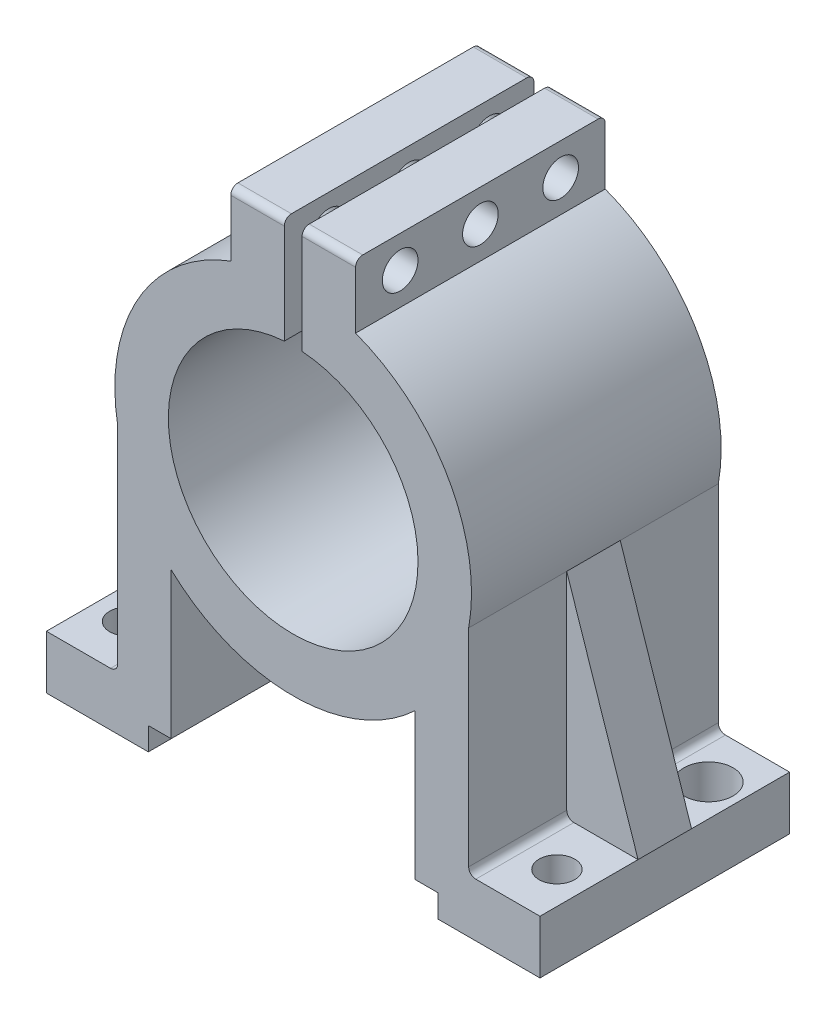
from build123d import *
from build123d.topology import SkipClean

# Parameters (mm, degrees)
BOSS_EXTRUDE1_DEPTH  = 28
BOSS_EXTRUDE2_START  = 11
BOSS_EXTRUDE2_DEPTH  = 6
CUT_EXTRUDE1_REACH   = 50.35
SKETCH3_R            = 2
FILLET1_R            = 0.8
SKETCH4_R            = 2
SKETCH4_R_2          = 2.75
CUT_EXTRUDE2_DEPTH   = 67.419950062
FILLET1_OF_MIRROR1_R = 0.8
CUT_EXTRUDE3_DEPTH   = 52.732976543


with BuildPart() as part:
    # Sketch1 → Boss-Extrude1 (new body)
    with BuildSketch(Plane.XY):
        with BuildLine():
            Line((0, 20), (0, 14))
            ThreePointArc((0, 14), (14, 0), (0, -14))
            Line((0, -14), (0, -20))
            ThreePointArc((0, -20), (7.356284672, -18.5979858), (13.681207787, -14.588507583))
            Line((13.681207787, -14.588507583), (13.681207787, -30.99669229))
            Line((13.681207787, -30.99669229), (16.241207787, -30.99669229))
            Line((16.241207787, -30.99669229), (16.241207787, -33.55669229))
            Line((16.241207787, -33.55669229), (27.681207787, -33.55669229))
            Line((27.681207787, -33.55669229), (27.681207787, -27.55669229))
            Line((27.681207787, -27.55669229), (20.481207787, -27.55669229))
            ThreePointArc((20.481207787, -27.55669229), (19.915522362, -27.322377715), (19.681207787, -26.75669229))
            Line((19.681207787, -26.75669229), (19.681207787, -3.55669229))
            ThreePointArc((19.681207787, -3.55669229), (17.38394465, 9.889310815), (7, 18.734993995))
            Line((7, 18.734993995), (7, 25.934993995))
            Line((7, 25.934993995), (0, 25.934993995))
            Line((0, 25.934993995), (0, 20))
        make_face()
    boss_extrude1 = extrude(amount=BOSS_EXTRUDE1_DEPTH)

    # Sketch2 → Boss-Extrude2 (add)
    with BuildSketch(Plane.XY.offset(BOSS_EXTRUDE2_START)):
        Polygon((19.681207787, -26.75669229), (19.681207787, -3.55669229), (27.681207787, -27.55669229), (20.481207787, -27.55669229), (19.681207787, -27.55669229), align=None)
    boss_extrude2 = extrude(amount=BOSS_EXTRUDE2_DEPTH)

    # Sketch3 → Cut-Extrude1 (cut, up to next)
    with BuildSketch(Plane(origin=(7, 0, 0), x_dir=(0, 0, -1), z_dir=(1, 0, 0)), mode=Mode.PRIVATE) as cut_extrude1_sk1:
        with Locations(Location((-23, 22.334993995, 0), (0, 0, 90))):
            Circle(SKETCH3_R)
    cut_extrude1_tool1 = extrude(cut_extrude1_sk1.sketch, amount=-CUT_EXTRUDE1_REACH, mode=Mode.PRIVATE) & part.part
    # Sketch3 → Cut-Extrude1 (cut, up to next)
    with BuildSketch(Plane(origin=(7, 0, 0), x_dir=(0, 0, -1), z_dir=(1, 0, 0)), mode=Mode.PRIVATE) as cut_extrude1_sk2:
        with Locations(Location((-14, 22.334993995, 0), (0, 0, 90))):
            Circle(SKETCH3_R)
    cut_extrude1_tool2 = extrude(cut_extrude1_sk2.sketch, amount=-CUT_EXTRUDE1_REACH, mode=Mode.PRIVATE) & part.part
    # Sketch3 → Cut-Extrude1 (cut, up to next)
    with BuildSketch(Plane(origin=(7, 0, 0), x_dir=(0, 0, -1), z_dir=(1, 0, 0)), mode=Mode.PRIVATE) as cut_extrude1_sk3:
        with Locations(Location((-5, 22.334993995, 0), (0, 0, 90))):
            Circle(SKETCH3_R)
    cut_extrude1_tool3 = extrude(cut_extrude1_sk3.sketch, amount=-CUT_EXTRUDE1_REACH, mode=Mode.PRIVATE) & part.part
    cut_extrude1_1 = cut_extrude1_tool1.solids().sort_by_distance((7, 22.334994, 23))[0]
    add(cut_extrude1_1, mode=Mode.SUBTRACT)
    cut_extrude1_2 = cut_extrude1_tool2.solids().sort_by_distance((7, 22.334994, 14))[0]
    add(cut_extrude1_2, mode=Mode.SUBTRACT)
    cut_extrude1_3 = cut_extrude1_tool3.solids().sort_by_distance((7, 22.334994, 5))[0]
    add(cut_extrude1_3, mode=Mode.SUBTRACT)
    cut_extrude1 = cut_extrude1_1 + cut_extrude1_2 + cut_extrude1_3  # Cut-Extrude1 as one shape, for the pattern or mirror that repeats it

    # Fillet1
    fillet1_edges = [part.edges().sort_by_distance(p)[0] for p in [
        (3.5, 25.934993995, 0),
        (3.5, 25.934993995, 28),
    ]]
    fillet(fillet1_edges, radius=FILLET1_R)

    # Sketch4 → Cut-Extrude2 (cut, through all)
    with BuildSketch(Plane(origin=(0, -27.55669229, 0), x_dir=(1, 0, 0), z_dir=(0, 1, 0))):
        with Locations(Location((24.081207787, -22.5, 0), (0, 0, 270))):
            Circle(SKETCH4_R)
        with Locations(Location((24.081207787, -5.5, 0), (0, 0, 270))):
            Circle(SKETCH4_R_2)
    cut_extrude2 = extrude(amount=-CUT_EXTRUDE2_DEPTH, mode=Mode.SUBTRACT)

    # Mirror1: Boss-Extrude1, Boss-Extrude2, Cut-Extrude1, Cut-Extrude2 across plane
    with SkipClean():  # the faces are left unmerged after this step: merging them gives an invalid solid
        add(boss_extrude1.mirror(Plane(origin=(0, 0, 0), x_dir=(0, 0, 1), z_dir=(1, 0, 0))))
        add(boss_extrude2.mirror(Plane(origin=(0, 0, 0), x_dir=(0, 0, 1), z_dir=(1, 0, 0))))
        add(cut_extrude1.mirror(Plane(origin=(0, 0, 0), x_dir=(0, 0, 1), z_dir=(1, 0, 0))), mode=Mode.SUBTRACT)
        add(cut_extrude2.mirror(Plane(origin=(0, 0, 0), x_dir=(0, 0, 1), z_dir=(1, 0, 0))), mode=Mode.SUBTRACT)

    # Fillet1 of Mirror1
    fillet1_of_mirror1_edges = [part.edges().sort_by_distance(p)[0] for p in [
        (-3.5, 25.934993995, 0),
        (-3.5, 25.934993995, 28),
    ]]
    fillet(fillet1_of_mirror1_edges, radius=FILLET1_OF_MIRROR1_R)

    # Sketch6 → Cut-Extrude3 (cut, through all)
    with BuildSketch(Plane.XY.offset(28)):
        with BuildLine():
            ThreePointArc((1, 13.964240044), (0, 14), (-1, 13.964240044))
            Line((-1, 13.964240044), (-1, 8.456424639))
            Line((-1, 8.456424639), (1, 8.456424639))
            Line((1, 8.456424639), (1, 13.964240044))
        make_face()
        with BuildLine():
            Line((-1, 8.456424639), (-1, 13.964240044))
            ThreePointArc((-1, 13.964240044), (-9.539392014, -10.246950766), (14, 0))
            ThreePointArc((14, 0), (10.246950766, 9.539392014), (1, 13.964240044))
            Line((1, 13.964240044), (1, 8.456424639))
            Line((1, 8.456424639), (-1, 8.456424639))
        make_face()
        with BuildLine():
            Line((0, 25.134993995), (-1, 25.134993995))
            Line((-1, 25.134993995), (-1, 13.964240044))
            ThreePointArc((-1, 13.964240044), (0, 14), (1, 13.964240044))
            Line((1, 13.964240044), (1, 25.134993995))
            Line((1, 25.134993995), (0, 25.134993995))
        make_face()
        Polygon((1, 41.813563352), (-1, 41.813563352), (-1, 25.134993995), (0, 25.134993995), (1, 25.134993995), align=None)
    extrude(amount=-CUT_EXTRUDE3_DEPTH, mode=Mode.SUBTRACT)


solid = part.part
